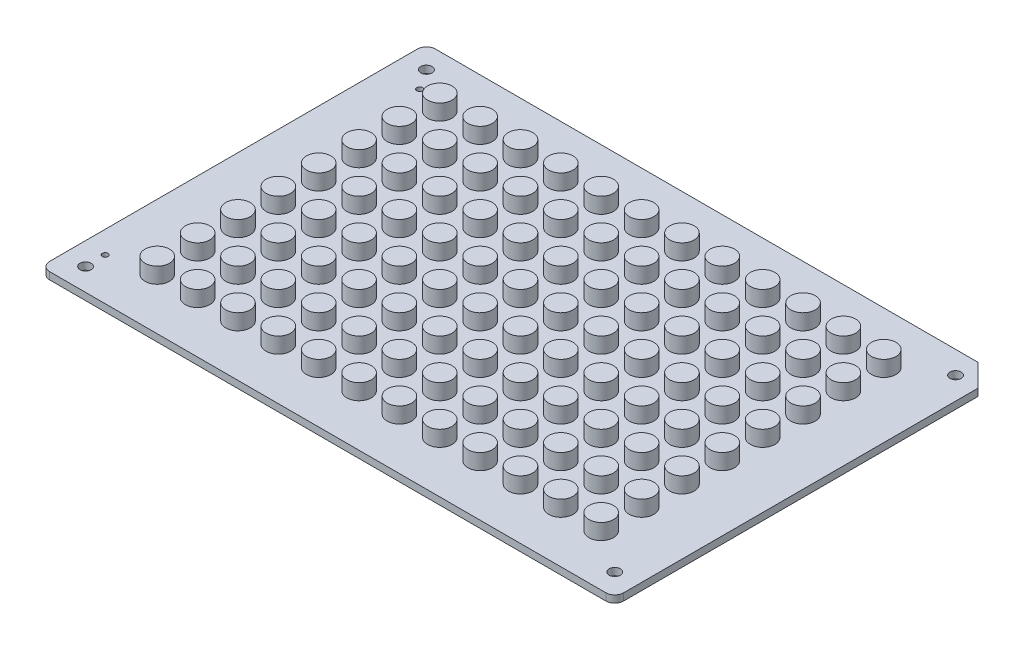
from build123d import *

# Parameters (mm, degrees)
SKETCH1_R           = 1.249995
SKETCH1_R_2         = 0.635
BOSS_EXTRUDE1_DEPTH = 1.6
SKETCH2_R           = 2.73
BOSS_EXTRUDE2_DEPTH = 3.5


with BuildPart() as part:
    # Sketch1 → Boss-Extrude1 (new body)
    with BuildSketch(Plane(origin=(0, 0, 0), x_dir=(1, 0, 0), z_dir=(0, 1, 0))):
        with BuildLine():
            Line((-43.032502905, 69.684700886), (-43.032502905, -12.315299112))
            ThreePointArc((-43.032502905, -12.315299112), (-42.446716467, -13.729512674), (-41.032502905, -14.315299112))
            Line((-41.032502905, -14.315299112), (82.967497096, -14.315299112))
            ThreePointArc((82.967497096, -14.315299112), (84.381710658, -13.729512674), (84.967497096, -12.315299112))
            Line((84.967497096, -12.315299112), (84.967497096, 66.684700886))
            Line((84.967497096, 66.684700886), (79.967497096, 71.684700886))
            Line((79.967497096, 71.684700886), (-41.032502905, 71.684700886))
            ThreePointArc((-41.032502905, 71.684700886), (-42.446716468, 71.098914448), (-43.032502905, 69.684700886))
        make_face()
        with Locations(Location((-38.032502906, 66.684700886, 0), (0, 0, 270))):
            Circle(SKETCH1_R, mode=Mode.SUBTRACT)
        with Locations(Location((-38.032502906, -9.315299112, 0), (0, 0, 270))):
            Circle(SKETCH1_R, mode=Mode.SUBTRACT)
        with Locations(Location((79.967497096, -9.315299112, 0), (0, 0, 270))):
            Circle(SKETCH1_R, mode=Mode.SUBTRACT)
        with Locations(Location((79.967497096, 66.684700886, 0), (0, 0, 270))):
            Circle(SKETCH1_R, mode=Mode.SUBTRACT)
        with Locations(Location((-38.079522906, -4.906099112, 0), (0, 0, 270))):
            Circle(SKETCH1_R_2, mode=Mode.SUBTRACT)
        with Locations(Location((-35.029522905, 62.173890886, 0), (0, 0, 270))):
            Circle(SKETCH1_R_2, mode=Mode.SUBTRACT)
    extrude(amount=BOSS_EXTRUDE1_DEPTH)

    # Sketch2 → Boss-Extrude2 (add)
    with BuildSketch(Plane(origin=(0, 1.6, 0), x_dir=(1, 0, 0), z_dir=(0, 1, 0))):
        with Locations(Location((-28.532502905, 60.169700886, 0), (0, 0, 270))):
            Circle(SKETCH2_R)
        with Locations(Location((-19.532502905, 60.169700886, 0), (0, 0, 270))):
            Circle(SKETCH2_R)
        with Locations(Location((-10.532502905, 60.169700886, 0), (0, 0, 270))):
            Circle(SKETCH2_R)
        with Locations(Location((-1.532502905, 60.169700886, 0), (0, 0, 270))):
            Circle(SKETCH2_R)
        with Locations(Location((7.467497095, 60.169700886, 0), (0, 0, 270))):
            Circle(SKETCH2_R)
        with Locations(Location((16.467497095, 60.169700886, 0), (0, 0, 270))):
            Circle(SKETCH2_R)
        with Locations(Location((25.467497095, 60.169700886, 0), (0, 0, 270))):
            Circle(SKETCH2_R)
        with Locations(Location((34.467497095, 60.169700886, 0), (0, 0, 270))):
            Circle(SKETCH2_R)
        with Locations(Location((43.467497095, 60.169700886, 0), (0, 0, 270))):
            Circle(SKETCH2_R)
        with Locations(Location((52.467497095, 60.169700886, 0), (0, 0, 270))):
            Circle(SKETCH2_R)
        with Locations(Location((61.467497095, 60.169700886, 0), (0, 0, 270))):
            Circle(SKETCH2_R)
        with Locations(Location((70.467497095, 60.169700886, 0), (0, 0, 270))):
            Circle(SKETCH2_R)
        with Locations(Location((-19.532502905, 51.169700886, 0), (0, 0, 270))):
            Circle(SKETCH2_R)
        with Locations(Location((-10.532502905, 51.169700886, 0), (0, 0, 270))):
            Circle(SKETCH2_R)
        with Locations(Location((-1.532502905, 51.169700886, 0), (0, 0, 270))):
            Circle(SKETCH2_R)
        with Locations(Location((7.467497095, 51.169700886, 0), (0, 0, 270))):
            Circle(SKETCH2_R)
        with Locations(Location((16.467497095, 51.169700886, 0), (0, 0, 270))):
            Circle(SKETCH2_R)
        with Locations(Location((25.467497095, 51.169700886, 0), (0, 0, 270))):
            Circle(SKETCH2_R)
        with Locations(Location((34.467497095, 51.169700886, 0), (0, 0, 270))):
            Circle(SKETCH2_R)
        with Locations(Location((43.467497095, 51.169700886, 0), (0, 0, 270))):
            Circle(SKETCH2_R)
        with Locations(Location((52.467497095, 51.169700886, 0), (0, 0, 270))):
            Circle(SKETCH2_R)
        with Locations(Location((61.467497095, 51.169700886, 0), (0, 0, 270))):
            Circle(SKETCH2_R)
        with Locations(Location((70.467497095, 51.169700886, 0), (0, 0, 270))):
            Circle(SKETCH2_R)
        with Locations(Location((-19.532502905, 42.169700886, 0), (0, 0, 270))):
            Circle(SKETCH2_R)
        with Locations(Location((-10.532502905, 42.169700886, 0), (0, 0, 270))):
            Circle(SKETCH2_R)
        with Locations(Location((-1.532502905, 42.169700886, 0), (0, 0, 270))):
            Circle(SKETCH2_R)
        with Locations(Location((7.467497095, 42.169700886, 0), (0, 0, 270))):
            Circle(SKETCH2_R)
        with Locations(Location((16.467497095, 42.169700886, 0), (0, 0, 270))):
            Circle(SKETCH2_R)
        with Locations(Location((25.467497095, 42.169700886, 0), (0, 0, 270))):
            Circle(SKETCH2_R)
        with Locations(Location((34.467497095, 42.169700886, 0), (0, 0, 270))):
            Circle(SKETCH2_R)
        with Locations(Location((43.467497095, 42.169700886, 0), (0, 0, 270))):
            Circle(SKETCH2_R)
        with Locations(Location((52.467497095, 42.169700886, 0), (0, 0, 270))):
            Circle(SKETCH2_R)
        with Locations(Location((61.467497095, 42.169700886, 0), (0, 0, 270))):
            Circle(SKETCH2_R)
        with Locations(Location((70.467497095, 42.169700886, 0), (0, 0, 270))):
            Circle(SKETCH2_R)
        with Locations(Location((-19.532502905, 33.169700886, 0), (0, 0, 270))):
            Circle(SKETCH2_R)
        with Locations(Location((-10.532502905, 33.169700886, 0), (0, 0, 270))):
            Circle(SKETCH2_R)
        with Locations(Location((-1.532502905, 33.169700886, 0), (0, 0, 270))):
            Circle(SKETCH2_R)
        with Locations(Location((7.467497095, 33.169700886, 0), (0, 0, 270))):
            Circle(SKETCH2_R)
        with Locations(Location((16.467497095, 33.169700886, 0), (0, 0, 270))):
            Circle(SKETCH2_R)
        with Locations(Location((25.467497095, 33.169700886, 0), (0, 0, 270))):
            Circle(SKETCH2_R)
        with Locations(Location((34.467497095, 33.169700886, 0), (0, 0, 270))):
            Circle(SKETCH2_R)
        with Locations(Location((43.467497095, 33.169700886, 0), (0, 0, 270))):
            Circle(SKETCH2_R)
        with Locations(Location((52.467497095, 33.169700886, 0), (0, 0, 270))):
            Circle(SKETCH2_R)
        with Locations(Location((61.467497095, 33.169700886, 0), (0, 0, 270))):
            Circle(SKETCH2_R)
        with Locations(Location((70.467497095, 33.169700886, 0), (0, 0, 270))):
            Circle(SKETCH2_R)
        with Locations(Location((-19.532502905, 24.169700886, 0), (0, 0, 270))):
            Circle(SKETCH2_R)
        with Locations(Location((-10.532502905, 24.169700886, 0), (0, 0, 270))):
            Circle(SKETCH2_R)
        with Locations(Location((-1.532502905, 24.169700886, 0), (0, 0, 270))):
            Circle(SKETCH2_R)
        with Locations(Location((7.467497095, 24.169700886, 0), (0, 0, 270))):
            Circle(SKETCH2_R)
        with Locations(Location((16.467497095, 24.169700886, 0), (0, 0, 270))):
            Circle(SKETCH2_R)
        with Locations(Location((25.467497095, 24.169700886, 0), (0, 0, 270))):
            Circle(SKETCH2_R)
        with Locations(Location((34.467497095, 24.169700886, 0), (0, 0, 270))):
            Circle(SKETCH2_R)
        with Locations(Location((43.467497095, 24.169700886, 0), (0, 0, 270))):
            Circle(SKETCH2_R)
        with Locations(Location((52.467497095, 24.169700886, 0), (0, 0, 270))):
            Circle(SKETCH2_R)
        with Locations(Location((61.467497095, 24.169700886, 0), (0, 0, 270))):
            Circle(SKETCH2_R)
        with Locations(Location((70.467497095, 24.169700886, 0), (0, 0, 270))):
            Circle(SKETCH2_R)
        with Locations(Location((-19.532502905, 15.169700886, 0), (0, 0, 270))):
            Circle(SKETCH2_R)
        with Locations(Location((-10.532502905, 15.169700886, 0), (0, 0, 270))):
            Circle(SKETCH2_R)
        with Locations(Location((-1.532502905, 15.169700886, 0), (0, 0, 270))):
            Circle(SKETCH2_R)
        with Locations(Location((7.467497095, 15.169700886, 0), (0, 0, 270))):
            Circle(SKETCH2_R)
        with Locations(Location((16.467497095, 15.169700886, 0), (0, 0, 270))):
            Circle(SKETCH2_R)
        with Locations(Location((25.467497095, 15.169700886, 0), (0, 0, 270))):
            Circle(SKETCH2_R)
        with Locations(Location((34.467497095, 15.169700886, 0), (0, 0, 270))):
            Circle(SKETCH2_R)
        with Locations(Location((43.467497095, 15.169700886, 0), (0, 0, 270))):
            Circle(SKETCH2_R)
        with Locations(Location((52.467497095, 15.169700886, 0), (0, 0, 270))):
            Circle(SKETCH2_R)
        with Locations(Location((61.467497095, 15.169700886, 0), (0, 0, 270))):
            Circle(SKETCH2_R)
        with Locations(Location((70.467497095, 15.169700886, 0), (0, 0, 270))):
            Circle(SKETCH2_R)
        with Locations(Location((-19.532502905, 6.169700886, 0), (0, 0, 270))):
            Circle(SKETCH2_R)
        with Locations(Location((-10.532502905, 6.169700886, 0), (0, 0, 270))):
            Circle(SKETCH2_R)
        with Locations(Location((-1.532502905, 6.169700886, 0), (0, 0, 270))):
            Circle(SKETCH2_R)
        with Locations(Location((7.467497095, 6.169700886, 0), (0, 0, 270))):
            Circle(SKETCH2_R)
        with Locations(Location((16.467497095, 6.169700886, 0), (0, 0, 270))):
            Circle(SKETCH2_R)
        with Locations(Location((25.467497095, 6.169700886, 0), (0, 0, 270))):
            Circle(SKETCH2_R)
        with Locations(Location((34.467497095, 6.169700886, 0), (0, 0, 270))):
            Circle(SKETCH2_R)
        with Locations(Location((43.467497095, 6.169700886, 0), (0, 0, 270))):
            Circle(SKETCH2_R)
        with Locations(Location((52.467497095, 6.169700886, 0), (0, 0, 270))):
            Circle(SKETCH2_R)
        with Locations(Location((61.467497095, 6.169700886, 0), (0, 0, 270))):
            Circle(SKETCH2_R)
        with Locations(Location((70.467497095, 6.169700886, 0), (0, 0, 270))):
            Circle(SKETCH2_R)
        with Locations(Location((-19.532502905, -2.830299114, 0), (0, 0, 270))):
            Circle(SKETCH2_R)
        with Locations(Location((-10.532502905, -2.830299114, 0), (0, 0, 270))):
            Circle(SKETCH2_R)
        with Locations(Location((-1.532502905, -2.830299114, 0), (0, 0, 270))):
            Circle(SKETCH2_R)
        with Locations(Location((7.467497095, -2.830299114, 0), (0, 0, 270))):
            Circle(SKETCH2_R)
        with Locations(Location((16.467497095, -2.830299114, 0), (0, 0, 270))):
            Circle(SKETCH2_R)
        with Locations(Location((25.467497095, -2.830299114, 0), (0, 0, 270))):
            Circle(SKETCH2_R)
        with Locations(Location((34.467497095, -2.830299114, 0), (0, 0, 270))):
            Circle(SKETCH2_R)
        with Locations(Location((43.467497095, -2.830299114, 0), (0, 0, 270))):
            Circle(SKETCH2_R)
        with Locations(Location((52.467497095, -2.830299114, 0), (0, 0, 270))):
            Circle(SKETCH2_R)
        with Locations(Location((61.467497095, -2.830299114, 0), (0, 0, 270))):
            Circle(SKETCH2_R)
        with Locations(Location((70.467497095, -2.830299114, 0), (0, 0, 270))):
            Circle(SKETCH2_R)
        with Locations(Location((-28.532502905, 51.169700886, 0), (0, 0, 270))):
            Circle(SKETCH2_R)
        with Locations(Location((-28.532502905, 42.169700886, 0), (0, 0, 270))):
            Circle(SKETCH2_R)
        with Locations(Location((-28.532502905, 33.169700886, 0), (0, 0, 270))):
            Circle(SKETCH2_R)
        with Locations(Location((-28.532502905, 24.169700886, 0), (0, 0, 270))):
            Circle(SKETCH2_R)
        with Locations(Location((-28.532502905, 15.169700886, 0), (0, 0, 270))):
            Circle(SKETCH2_R)
        with Locations(Location((-28.532502905, 6.169700886, 0), (0, 0, 270))):
            Circle(SKETCH2_R)
        with Locations(Location((-28.532502905, -2.830299114, 0), (0, 0, 270))):
            Circle(SKETCH2_R)
    extrude(amount=BOSS_EXTRUDE2_DEPTH)


solid = part.part
